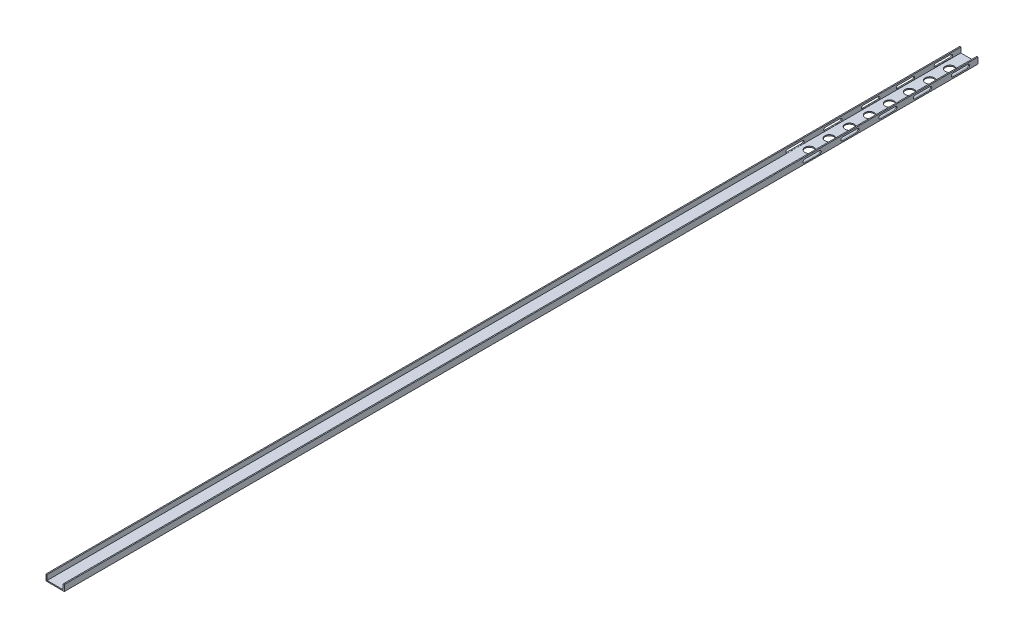
from build123d import *

# Parameters (mm, degrees)
BOSS_EXTRUDE1_DEPTH                     = 1247.2780762
BOSS_EXTRUDE1_DEPTH_BACK                = 0.0001
CBORE_FOR_M5_HEX_HEAD_BOLT1_D           = 5.8
CBORE_FOR_M5_HEX_HEAD_BOLT1_CBORE_D     = 12.238
CBORE_FOR_M5_HEX_HEAD_BOLT1_CBORE_DEPTH = 3.5
SKETCH12_R                              = 2.192561761
SKETCH12_R_2                            = 2.198183891
SKETCH12_R_3                            = 2.178555517
SKETCH12_R_4                            = 2.1825859
SKETCH12_R_5                            = 2.191093622
SKETCH12_R_6                            = 2.184131757
SKETCH12_W                              = 20.639060425
SKETCH12_H                              = 4.385123522
SKETCH12_W_2                            = 20.62721893
CUT_EXTRUDE3_DEPTH                      = 219
SCALE1_SCALE                            = 1.8


with BuildPart() as part:
    # Sketch1 → Boss-Extrude1 (new, two sides: drawn at the far end of the back side and taken through both)
    with BuildSketch(Plane.XY.offset(-BOSS_EXTRUDE1_DEPTH_BACK)):
        Polygon((-11.227272727, -5.287267028), (10.772727273, -5.287267028), (10.772727273, 1.712732972), (12.272727273, 1.712732972), (12.272727273, -6.687267028), (-12.727272727, -6.687267028), (-12.727272727, 1.712732972), (-11.227272727, 1.712732972), align=None)
    extrude(amount=BOSS_EXTRUDE1_DEPTH + BOSS_EXTRUDE1_DEPTH_BACK)

    # CBORE for M5 Hex Head Bolt1 (through all)
    with Locations(Plane(origin=(0, -5.287267028, 0), x_dir=(1, 0, 0), z_dir=(0, 1, 0))):
        with Locations((0, -26.226555277), (0, -53.601555277), (0, -80.976555277), (0, -108.351555277), (0, -135.726555277), (0, -163.101555277), (0, -190.476555277), (0, -217.851555277)):
            CounterBoreHole(CBORE_FOR_M5_HEX_HEAD_BOLT1_D / 2, CBORE_FOR_M5_HEX_HEAD_BOLT1_CBORE_D / 2, CBORE_FOR_M5_HEX_HEAD_BOLT1_CBORE_DEPTH)

    # Sketch12 → Cut-Extrude3 (cut)
    with BuildSketch(Plane.ZY.offset(12.727272727)):
        with Locations((13.543356252, -2.543007858)):
            Circle(SKETCH12_R)
        with Locations((34.182416677, -2.543007858)):
            Circle(SKETCH12_R_2)
        with Locations((65.305213992, -2.710382167)):
            Circle(SKETCH12_R)
        with Locations((85.932432922, -2.710382167)):
            Circle(SKETCH12_R_3)
        with Locations((112.703179644, -2.640183104)):
            Circle(SKETCH12_R)
        with Locations((133.330398574, -2.640183104)):
            Circle(SKETCH12_R_4)
        with Locations((164.345985992, -2.803798306)):
            Circle(SKETCH12_R)
        with Locations((184.973204922, -2.803798306)):
            Circle(SKETCH12_R_5)
        with Locations((216.107843732, -2.971172615)):
            Circle(SKETCH12_R)
        with Locations((236.735062662, -2.971172615)):
            Circle(SKETCH12_R_6)
        with Locations((23.862886465, -2.543007858)):
            Rectangle(SKETCH12_W, SKETCH12_H)
        with Locations((75.618823457, -2.710382167)):
            Rectangle(SKETCH12_W_2, SKETCH12_H)
        with Locations((123.016789109, -2.640183104)):
            Rectangle(SKETCH12_W_2, SKETCH12_H)
        with Locations((174.659595457, -2.803798306)):
            Rectangle(SKETCH12_W_2, SKETCH12_H)
        with Locations((226.421453197, -2.971172615)):
            Rectangle(SKETCH12_W_2, SKETCH12_H)
    extrude(amount=-CUT_EXTRUDE3_DEPTH, mode=Mode.SUBTRACT)


with BuildPart() as part_1:
    # Scale1: scaled about (0, 0, 0)
    add(part.part.scale(SCALE1_SCALE))


solid = part_1.part
